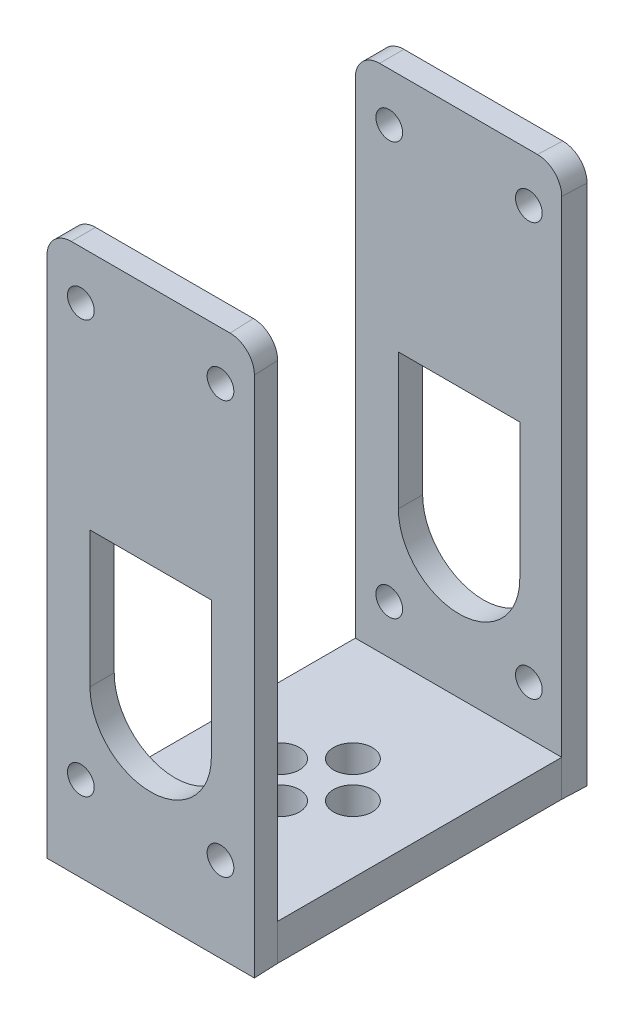
from build123d import *

# Parameters (mm, degrees)
SKETCH_1_W          = 17
SKETCH_1_H          = 23.4
SKETCH_1_R          = 1.6
EXTRUDE_1_DEPTH     = 3
EXTRUDE_3_DEPTH     = 45
SKETCH_3_R          = 1.1
SKETCH_3_R_2        = 5
CUT_EXTRUDE_1_DEPTH = 45
FILLET_1_R          = 2
SKETCH_4_W          = 10
SKETCH_4_H          = 11.187827488
CUT_EXTRUDE_2_DEPTH = 29


with BuildPart() as part:
    # 草图1 → 凸台-拉伸1 (new body)
    with BuildSketch(Plane(origin=(0, 0, 0), x_dir=(1, 0, 0), z_dir=(0, 1, 0))):
        Rectangle(SKETCH_1_W, SKETCH_1_H)
        with Locations(Location((0, 3, 0), (0, 0, 270))):
            Circle(SKETCH_1_R, mode=Mode.SUBTRACT)
        with Locations(Location((-3, 0, 0), (0, 0, 270))):
            Circle(SKETCH_1_R, mode=Mode.SUBTRACT)
        with Locations(Location((0, -3, 0), (0, 0, 90))):
            Circle(SKETCH_1_R, mode=Mode.SUBTRACT)
        with Locations(Location((3, 0, 0), (0, 0, 90))):
            Circle(SKETCH_1_R, mode=Mode.SUBTRACT)
    extrude(amount=EXTRUDE_1_DEPTH)

    # 草图2 → 凸台-拉伸3 (add)
    with BuildSketch(Plane.XZ):
        Polygon((-8.5, 11.7), (-8.5, 13.7), (8.584010661, 13.7), (8.5, 11.7), align=None)
        Polygon((8.584010661, -13.7), (8.5, -11.7), (-8.5, -11.7), (-8.5, -13.7), align=None)
    extrude(amount=-EXTRUDE_3_DEPTH)

    # 草图3 → 切除-拉伸1 (cut)
    with BuildSketch(Plane.XY.offset(13.7)):
        with Locations((-5.707994669, 41)):
            Circle(SKETCH_3_R)
        with Locations((5.792005331, 41)):
            Circle(SKETCH_3_R)
        with Locations((0.042005331, 14)):
            Circle(SKETCH_3_R_2)
        with Locations((-5.707994669, 7)):
            Circle(SKETCH_3_R)
        with Locations((5.792005331, 7)):
            Circle(SKETCH_3_R)
    extrude(amount=-CUT_EXTRUDE_1_DEPTH, mode=Mode.SUBTRACT)

    # 圆角1
    fillet_1_edges = [part.edges().sort_by_distance(p)[0] for p in [
        (-8.5, 45, 12.7),
        (8.542005331, 45, 12.7),
        (-8.5, 45, -12.7),
        (8.542005331, 45, -12.7),
    ]]
    fillet(fillet_1_edges, radius=FILLET_1_R)

    # 草图4 → 切除-拉伸2 (cut)
    with BuildSketch(Plane.XY.offset(13.7)):
        with Locations((0.042005331, 19.593913744)):
            Rectangle(SKETCH_4_W, SKETCH_4_H)
    extrude(amount=-CUT_EXTRUDE_2_DEPTH, mode=Mode.SUBTRACT)


solid = part.part
